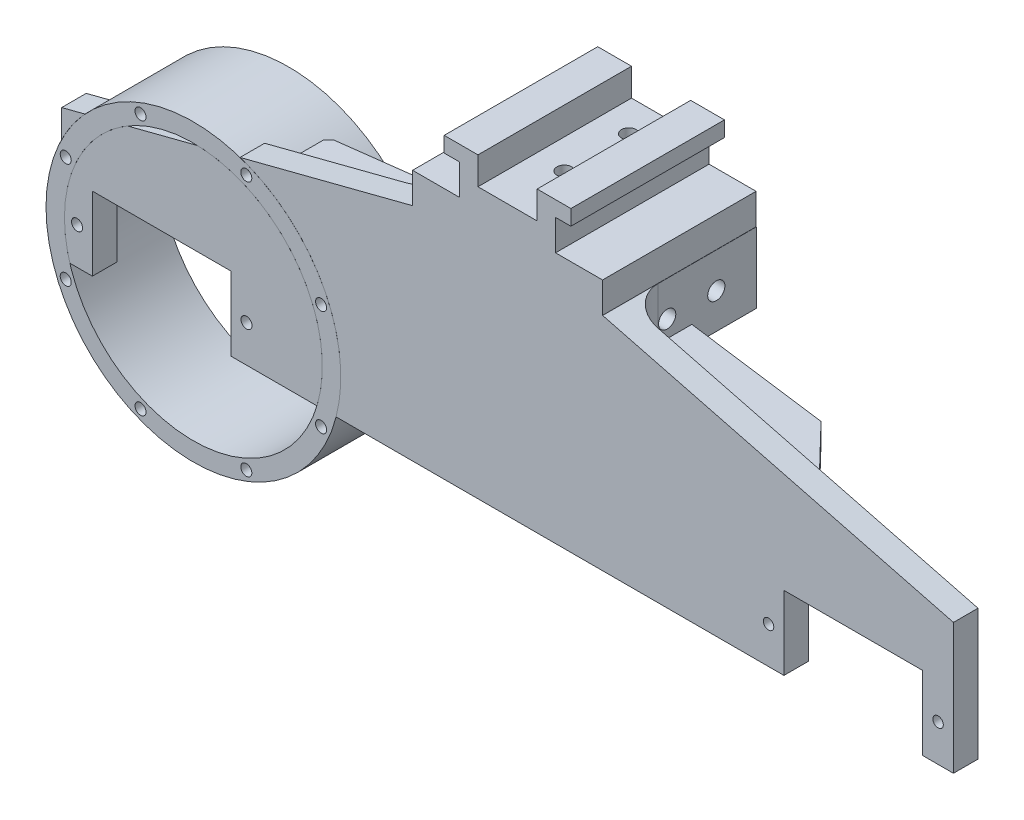
from build123d import *

# Parameters (mm, degrees)
ESQUISSE1_R                  = 0.85
BOSS_EXTRU_1_DEPTH           = 4
ESQUISSE2_W                  = 5
ESQUISSE2_H                  = 11.5
BOSS_EXTRU_2_DEPTH           = 21
ESQUISSE3_R                  = 1.4
ENL_V_MAT_EXTRU_1_DEPTH      = 93.33964479
CONG_1_R                     = 5
BOSS_EXTRU_3_DEPTH           = 3
BOSS_EXTRU_4_DEPTH           = 25
ESQUISSE6_R                  = 1.2
ENL_V_MAT_EXTRU_2_DEPTH      = 84.712364678
BOSS_EXTRU_6_DEPTH           = 4.5
BOSS_EXTRU_6_DEPTH_BACK      = 4
ESQUISSE9_R                  = 24
ESQUISSE9_R_2                = 21
BOSS_EXTRU_7_DEPTH           = 7
ENL_V_MAT_EXTRU_3_DEPTH      = 87.997255704
ENL_V_MAT_EXTRU_3_DEPTH_BACK = 87.997255704
ESQUISSE11_R                 = 0.9
ENL_V_MAT_EXTRU_4_DEPTH      = 87.997255704
ENL_V_MAT_EXTRU_4_DEPTH_BACK = 87.997255704
ESQUISSE12_R                 = 0.9


with BuildPart() as part:
    # Esquisse1 → Boss.-Extru.1 (new body)
    with BuildSketch(Plane.XY):
        Polygon((15.5, 18), (-15.5, 18), (-72.6, 3.278696541), (-72.6, -18), (-67.6, -18), (-67.6, -6), (-45, -6), (-45, -18), (45, -18), (45, -6), (67.6, -6), (67.6, -18), (72.6, -18), (72.6, 3.278696541), align=None)
        with Locations((-42.5, -12)):
            Circle(ESQUISSE1_R, mode=Mode.SUBTRACT)
        with Locations((-70.1, -12)):
            Circle(ESQUISSE1_R, mode=Mode.SUBTRACT)
        with Locations(Location((42.5, -12, 0), (0, 0, 180))):
            Circle(ESQUISSE1_R, mode=Mode.SUBTRACT)
        with Locations(Location((70.1, -12, 0), (0, 0, 180))):
            Circle(ESQUISSE1_R, mode=Mode.SUBTRACT)
    extrude(amount=BOSS_EXTRU_1_DEPTH)

    # Esquisse2 → Boss.-Extru.2 (add)
    with BuildSketch(Plane(origin=(0, 0, 0), x_dir=(-1, 0, 0), z_dir=(0, 0, -1))):
        with Locations((-13, 12.25)):
            Rectangle(ESQUISSE2_W, ESQUISSE2_H)
        with Locations((13, 12.25)):
            Rectangle(ESQUISSE2_W, ESQUISSE2_H)
    extrude(amount=BOSS_EXTRU_2_DEPTH)

    # Esquisse3 → Enlèv. mat.-Extru.1 (cut, through all)
    with BuildSketch(Plane.ZY.offset(15.5)):
        with Locations((-6.49, 12.25)):
            Circle(ESQUISSE3_R)
        with Locations((-14.49, 12.25)):
            Circle(ESQUISSE3_R)
    extrude(amount=-ENL_V_MAT_EXTRU_1_DEPTH, mode=Mode.SUBTRACT)

    # Congé1
    cong_1_edges = [part.edges().sort_by_distance(p)[0] for p in [
        (-15.5, 12.25, 0),
        (15.5, 12.25, 0),
    ]]
    fillet(cong_1_edges, radius=CONG_1_R)

    # Esquisse4 → Boss.-Extru.3 (add)
    with BuildSketch(Plane.XZ.offset(-6.5)):
        Polygon((-15.5, -10.5), (-39.70316927, -7.340935878), (-46.787327396, 0), (-10.5, 0), (-10.5, -10.5), align=None)
        Polygon((15.5, -10.5), (10.5, -10.5), (10.5, 0), (46.787327396, 0), (39.70316927, -7.340935878), align=None)
    extrude(amount=-BOSS_EXTRU_3_DEPTH)

    # Esquisse5 → Boss.-Extru.4 (add, through all)
    with BuildSketch(Plane.XY.offset(4)):
        Polygon((-15.466226842, 23), (-15.466226842, 18), (15.466226842, 18), (15.466226842, 23), (7.816226842, 23), (7.816226842, 28), (10.316226842, 28), (10.316226842, 30.5), (4.816226842, 30.5), (4.816226842, 26), (-4.816226842, 26), (-4.816226842, 30.5), (-10.316226842, 30.5), (-10.316226842, 28), (-7.816226842, 28), (-7.816226842, 23), align=None)
    extrude(amount=-BOSS_EXTRU_4_DEPTH)

    # Esquisse6 → Enlèv. mat.-Extru.2 (cut, through all)
    with BuildSketch(Plane.XZ.offset(-18)):
        with Locations(Location((0, -5.25, 0), (0, 0, 270))):
            Circle(ESQUISSE6_R)
        with Locations(Location((0, -15.7500125, 0), (0, 0, 270))):
            Circle(ESQUISSE6_R)
    extrude(amount=-ENL_V_MAT_EXTRU_2_DEPTH, mode=Mode.SUBTRACT)

    # Esquisse9 → Boss.-Extru.6 (add, two sides: drawn at the far end of the back side and taken through both)
    with BuildSketch(Plane(origin=(0, 0, 0), x_dir=(-1, 0, 0), z_dir=(0, 0, -1)).offset(-BOSS_EXTRU_6_DEPTH_BACK)):
        with Locations((51.15, -12)):
            Circle(ESQUISSE9_R)
        with Locations((51.15, -12)):
            Circle(ESQUISSE9_R_2, mode=Mode.SUBTRACT)
    extrude(amount=BOSS_EXTRU_6_DEPTH + BOSS_EXTRU_6_DEPTH_BACK)

    # Esquisse10 → Boss.-Extru.7 (add)
    with BuildSketch(Plane(origin=(0, 0, -4.5), x_dir=(-1, 0, 0), z_dir=(0, 0, -1))):
        with BuildLine():
            Line((27.255701517, -9.75), (30.270883639, -9.75))
            ThreePointArc((30.270883639, -9.75), (51.15, 9), (72.029116361, -9.75))
            Line((72.029116361, -9.75), (75.044298483, -9.75))
            ThreePointArc((75.044298483, -9.75), (51.15, 12), (27.255701517, -9.75))
        make_face()
        with BuildLine():
            Line((27.255701517, -14.25), (30.270883639, -14.25))
            ThreePointArc((30.270883639, -14.25), (51.15, -33), (72.029116361, -14.25))
            Line((72.029116361, -14.25), (75.044298483, -14.25))
            ThreePointArc((75.044298483, -14.25), (51.15, -36), (27.255701517, -14.25))
        make_face()
    extrude(amount=BOSS_EXTRU_7_DEPTH)

    # Esquisse11 → Enlèv. mat.-Extru.3 (cut, two sides: drawn at the far end of the back side and taken through both)
    with BuildSketch(Plane.XY.offset(4).offset(-ENL_V_MAT_EXTRU_3_DEPTH_BACK)):
        with Locations((-70.1, -12)):
            Circle(ESQUISSE11_R)
        with Locations((-42.5, -12)):
            Circle(ESQUISSE11_R)
    extrude(amount=ENL_V_MAT_EXTRU_3_DEPTH + ENL_V_MAT_EXTRU_3_DEPTH_BACK, mode=Mode.SUBTRACT)

    # Esquisse12 → Enlèv. mat.-Extru.4 (cut, two sides: drawn at the far end of the back side and taken through both)
    with BuildSketch(Plane.XY.offset(4).offset(-ENL_V_MAT_EXTRU_4_DEPTH_BACK)):
        with Locations((-71.937289482, -3.389622772)):
            Circle(ESQUISSE12_R)
        with Locations((-59.760377228, 8.787289482)):
            Circle(ESQUISSE12_R)
        with Locations((-42.539622772, 8.787289482)):
            Circle(ESQUISSE12_R)
        with Locations((-30.362710518, -3.389622772)):
            Circle(ESQUISSE12_R)
        with Locations((-30.362710518, -20.610377228)):
            Circle(ESQUISSE12_R)
        with Locations((-42.539622772, -32.787289482)):
            Circle(ESQUISSE12_R)
        with Locations((-59.760377228, -32.787289482)):
            Circle(ESQUISSE12_R)
        with Locations((-71.937289482, -20.610377228)):
            Circle(ESQUISSE12_R)
    extrude(amount=ENL_V_MAT_EXTRU_4_DEPTH + ENL_V_MAT_EXTRU_4_DEPTH_BACK, mode=Mode.SUBTRACT)


solid = part.part
